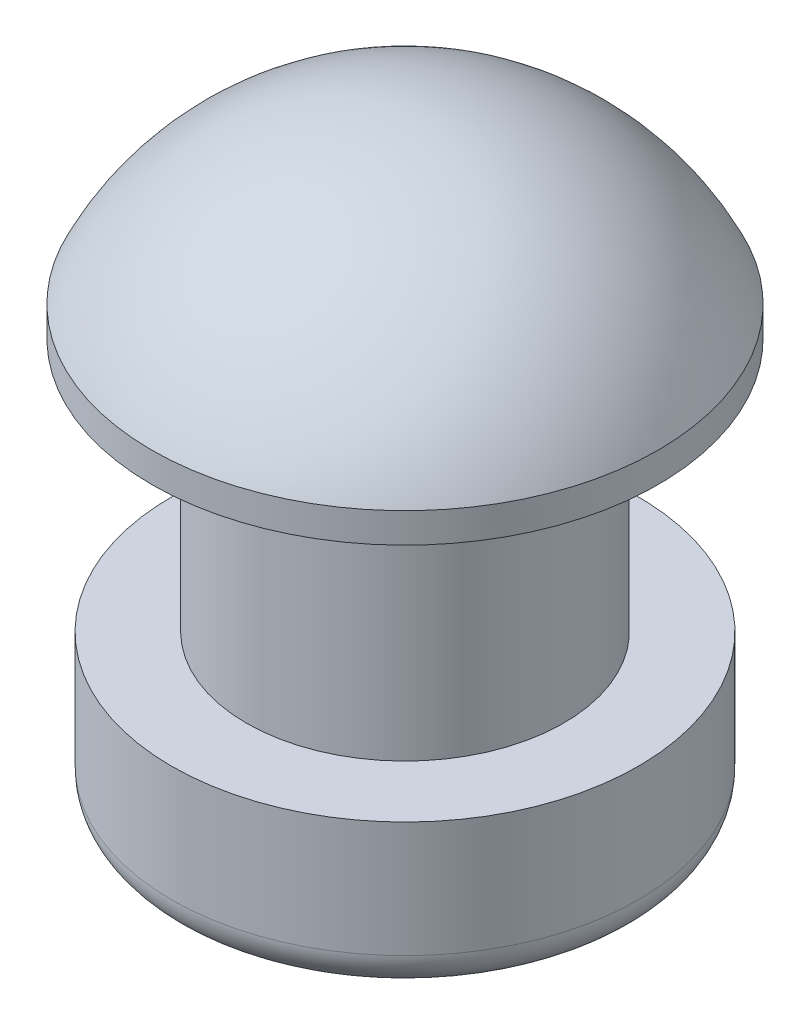
from build123d import *

# Parameters (mm, degrees)
FILLET1_R = 0.508


with BuildPart() as part:
    # Sketch1 → Revolve1 (revolve)
    with BuildSketch(Plane.XY, mode=Mode.PRIVATE) as revolve1_sk:
        with BuildLine():
            Line((0, 5.08), (0, 0))
            ThreePointArc((0, 0), (1.261643301, -0.667825992), (2.159, -1.778))
            Line((2.159, -1.778), (2.159, -3.048))
            Line((2.159, -3.048), (3.175, -3.048))
            Line((3.175, -3.048), (3.175, -0.9652))
            Line((3.175, -0.9652), (2.159, -0.9652))
            Line((2.159, -0.9652), (2.159, 2.4892))
            Line((2.159, 2.4892), (3.445798114, 2.4892))
            Line((3.445798114, 2.4892), (3.445798114, 2.8956))
            ThreePointArc((3.445798114, 2.8956), (2.039922057, 4.487890303), (0, 5.08))
        make_face()
    revolve(revolve1_sk.sketch.rotate(Axis((0, 5.379452632, 0), (0, -1, 0)), 90), axis=Axis((0, 5.379452632, 0), (0, -1, 0)))

    # Fillet1
    fillet1_edges = [part.edges().sort_by_distance(p)[0] for p in [
        (0, -3.048, -3.175),
    ]]
    fillet(fillet1_edges, radius=FILLET1_R)


solid = part.part
